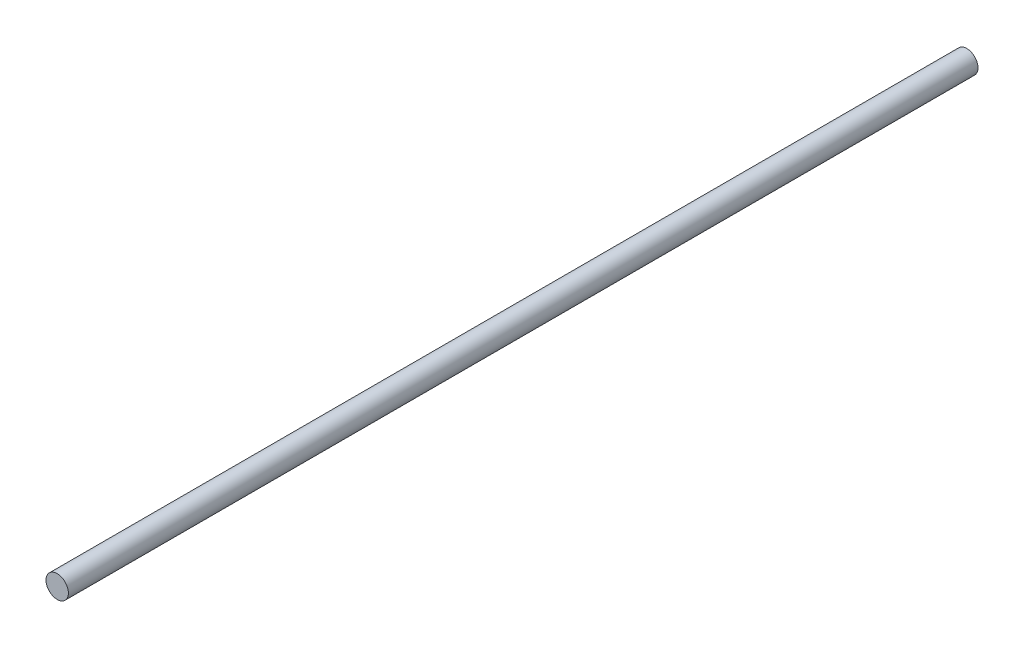
from build123d import *

# Parameters (mm, degrees)
SKETCH1_R            = 16
REFERENCE_ONLY_DEPTH = 1300


with BuildPart() as part:
    # Sketch1 → Reference_only (new body)
    with BuildSketch(Plane.XY):
        with Locations((16, 16)):
            Circle(SKETCH1_R)
    extrude(amount=REFERENCE_ONLY_DEPTH)


solid = part.part
